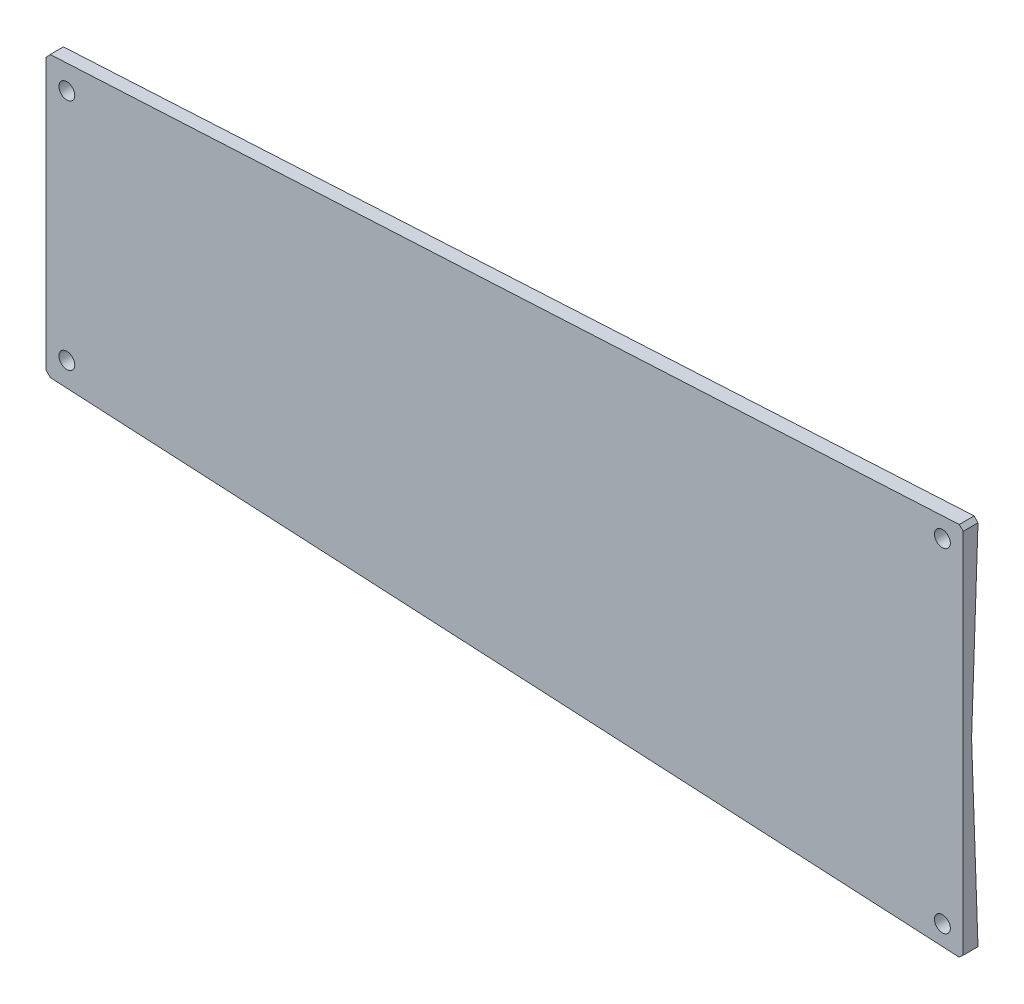
from build123d import *

# Parameters (mm, degrees)
ESQUISSE1_R      = 1.9
EXTRUSION1_DEPTH = 2
D_POUILLE2_ANGLE = 2
CHANFREIN1_SIZE  = 1
CHANFREIN1_SIZE2 = 1.056596466
CHANFREIN2_SIZE  = 1
CHANFREIN2_SIZE2 = 1.056596466
CHANFREIN4_SIZE  = 1
CHANFREIN4_SIZE2 = 0.951621439
CHANFREIN5_SIZE  = 1
CHANFREIN5_SIZE2 = 0.951621439


with BuildPart() as part:
    # Esquisse1 → Extrusion1 (new body)
    with BuildSketch(Plane.XY):
        Polygon((32.89280914, 0), (32.89280914, 45), (-187.10719086, 33.5), (-187.10719086, 0), align=None)
        with Locations((-182.10719086, 28)):
            Circle(ESQUISSE1_R, mode=Mode.SUBTRACT)
        with Locations((27.89280914, 40)):
            Circle(ESQUISSE1_R, mode=Mode.SUBTRACT)
    extrude(amount=EXTRUSION1_DEPTH)

    # Dépouille2
    d_pouille2_faces = [part.faces().sort_by_distance(p)[0] for p in [
        (-71.721493892, 19.727903034, 0),
    ]]
    draft(d_pouille2_faces, Plane(origin=(32.89280914, 0, 2), x_dir=(-1, 0, 0), z_dir=(0, -1, 0)), D_POUILLE2_ANGLE)

    # Symétrie1: part across plane


with BuildPart() as part_1:
    add(part.part)
    add(part.part.mirror(Plane(origin=(32.89280914, 0, 2), x_dir=(0, 0, 1), z_dir=(0, 1, 0))))

    # Chanfrein1
    chanfrein1_edges = [part_1.edges().sort_by_distance(p)[0] for p in [
        (-187.10719086, 33.5, 0.415077111),
    ]]
    chanfrein1_side = [part_1.faces().sort_by_distance(p)[0] for p in [
        (-74.922898918, 39.364178897, 0.312686291),
    ]]
    chamfer(chanfrein1_edges, length=CHANFREIN1_SIZE, length2=CHANFREIN1_SIZE2, reference=chanfrein1_side[0])

    # Chanfrein2
    chanfrein2_edges = [part_1.edges().sort_by_distance(p)[0] for p in [
        (-187.10719086, -33.5, 0.415077111),
    ]]
    chanfrein2_side = [part_1.faces().sort_by_distance(p)[0] for p in [
        (-187.10719086, -0.646362154, 0.690599114),
    ]]
    chamfer(chanfrein2_edges, length=CHANFREIN2_SIZE, length2=CHANFREIN2_SIZE2, reference=chanfrein2_side[0])

    # Chanfrein4
    chanfrein4_edges = [part_1.edges().sort_by_distance(p)[0] for p in [
        (32.89280914, -45, 0.214282686),
    ]]
    chanfrein4_side = [part_1.faces().sort_by_distance(p)[0] for p in [
        (-74.416841112, -39.390631919, 0.312224411),
    ]]
    chamfer(chanfrein4_edges, length=CHANFREIN4_SIZE, length2=CHANFREIN4_SIZE2, reference=chanfrein4_side[0])

    # Chanfrein5
    chanfrein5_edges = [part_1.edges().sort_by_distance(p)[0] for p in [
        (32.89280914, 45, 0.214282686),
    ]]
    chanfrein5_side = [part_1.faces().sort_by_distance(p)[0] for p in [
        (32.89280914, 0.608982965, 0.574960444),
    ]]
    chamfer(chanfrein5_edges, length=CHANFREIN5_SIZE, length2=CHANFREIN5_SIZE2, reference=chanfrein5_side[0])


solid = part_1.part
